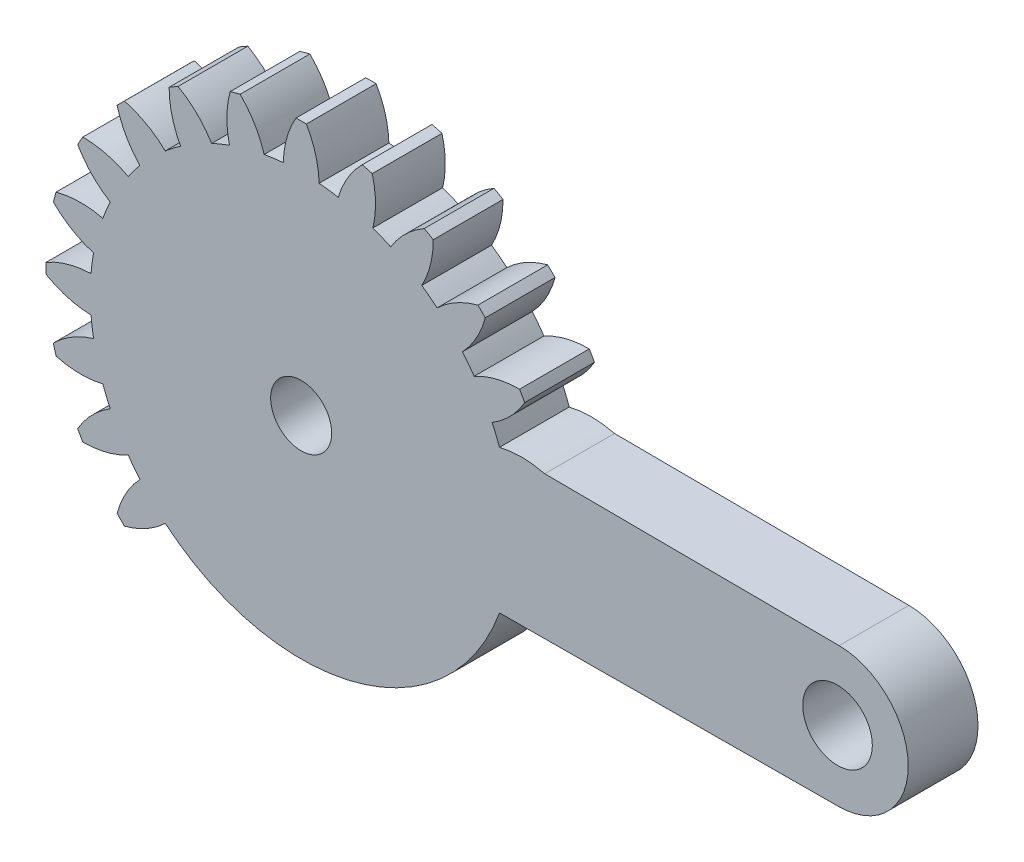
from build123d import *

# Parameters (mm, degrees)
SKETCH1_R           = 12.09
SKETCH1_R_2         = 1.75
SKETCH1_R_3         = 1.995
BOSS_EXTRUDE1_DEPTH = 4


with BuildPart() as part:
    # Sketch1 → Boss-Extrude1 (new body)
    # profile 1 of 22: a face of its own
    with BuildSketch(Plane.XY):
        Circle(SKETCH1_R)
        Circle(SKETCH1_R_2, mode=Mode.SUBTRACT)
    # profile 2 of 22: a face of its own
    with BuildSketch(Plane.XY):
        with BuildLine():
            ThreePointArc((14.051469909, -4.073462091), (14.048317136, -4.084321933), (14.04515597, -4.095179336))
            Line((14.04515597, -4.095179336), (30.82582707, -3.999919373))
            ThreePointArc((30.82582707, -3.999919373), (34.803112279, -0.008027822), (30.841914591, 3.999828048))
            Line((30.841914591, 3.999828048), (14.04515597, 4.095179336))
            ThreePointArc((14.04515597, 4.095179336), (14.128586435, 3.797360314), (14.205702589, 3.497844187))
            ThreePointArc((14.205702589, 3.497844187), (14.50484412, 1.909554151), (14.626965513, 0.297959519))
            ThreePointArc((14.626965513, 0.297959519), (14.629241359, 0.148987485), (14.63, 0))
            ThreePointArc((14.63, 0), (14.629241116, -0.149011314), (14.626964543, -0.298007168))
            ThreePointArc((14.626964543, -0.298007168), (14.504858624, -1.909443973), (14.20576712, -3.497582099))
            ThreePointArc((14.20576712, -3.497582099), (14.131552306, -3.786308154), (14.051469909, -4.073462091))
        make_face()
        with Locations((30.75, 0)):
            Circle(SKETCH1_R_3, mode=Mode.SUBTRACT)
    # profile 3 of 22: a face of its own
    with BuildSketch(Plane.XY):
        with BuildLine():
            ThreePointArc((14.205702589, 3.497844187), (14.128586435, 3.797360314), (14.04515597, 4.095179336))
            Line((14.04515597, 4.095179336), (13.966164937, 4.095627749))
            Line((13.966164937, 4.095627749), (11.369827915, 4.11036655))
            ThreePointArc((11.369827915, 4.11036655), (11.678097516, 3.128919686), (11.901816808, 2.124819208))
            ThreePointArc((11.901816808, 2.124819208), (13.1403578, 2.666023245), (14.205702589, 3.497844187))
        make_face()
    # profile 4 of 22: a face of its own
    with BuildSketch(Plane.XY):
        with BuildLine():
            ThreePointArc((-12.517636695, -7.572692492), (-11.175984377, -7.407777173), (-9.917325106, -6.914821961))
            ThreePointArc((-9.917325106, -6.914821961), (-10.469253219, -6.046721181), (-10.945386333, -5.134843524))
            ThreePointArc((-10.945386333, -5.134843524), (-12.001489862, -5.978375477), (-12.815033037, -7.057749518))
            ThreePointArc((-12.815033037, -7.057749518), (-12.668951436, -7.31673216), (-12.517636695, -7.572692492))
        make_face()
    # profile 5 of 22: a face of its own
    with BuildSketch(Plane.XY):
        with BuildLine():
            ThreePointArc((-14.051145033, -4.074582586), (-12.712516328, -4.262616236), (-11.369129658, -4.112297512))
            ThreePointArc((-11.369129658, -4.112297512), (-11.677558471, -3.130930876), (-11.901445615, -2.126897335))
            ThreePointArc((-11.901445615, -2.126897335), (-13.139881298, -2.668425004), (-14.205038564, -3.500539874))
            ThreePointArc((-14.205038564, -3.500539874), (-14.13100701, -3.788342761), (-14.051145033, -4.074582586))
        make_face()
    # profile 6 of 22: a face of its own
    with BuildSketch(Plane.XY):
        with BuildLine():
            ThreePointArc((-14.626950262, -0.298707293), (-13.382615157, -0.826868574), (-12.046093246, -1.029435529))
            ThreePointArc((-12.046093246, -1.029435529), (-12.089999882, -0.001686428), (-12.046379968, 1.026074882))
            ThreePointArc((-12.046379968, 1.026074882), (-13.382791491, 0.823465153), (-14.62701917, 0.295313712))
            ThreePointArc((-14.62701917, 0.295313712), (-14.629999902, -0.00169714), (-14.626950262, -0.298707293))
        make_face()
    # profile 7 of 22: a face of its own
    with BuildSketch(Plane.XY):
        with BuildLine():
            ThreePointArc((-14.205774364, 3.497552675), (-13.140565234, 2.66528054), (-11.902026335, 2.123645243))
            ThreePointArc((-11.902026335, 2.123645243), (-11.678416405, 3.127729251), (-11.370260409, 4.109170017))
            ThreePointArc((-11.370260409, 4.109170017), (-12.71360248, 4.259309779), (-14.052145793, 4.071129894))
            ThreePointArc((-14.052145793, 4.071129894), (-14.131870386, 3.78512079), (-14.205774364, 3.497552675))
        make_face()
    # profile 8 of 22: a face of its own
    with BuildSketch(Plane.XY):
        with BuildLine():
            ThreePointArc((-9.919135011, 6.912225448), (-11.177872267, 7.404913556), (-12.519533027, 7.569556974))
            ThreePointArc((-12.519533027, 7.569556974), (-12.670533379, 7.313992337), (-12.816317544, 7.055416686))
            ThreePointArc((-12.816317544, 7.055416686), (-12.00284137, 5.975783406), (-10.94671211, 5.132016561))
            ThreePointArc((-10.94671211, 5.132016561), (-10.470825179, 6.043998682), (-9.919135011, 6.912225448))
        make_face()
    # profile 9 of 22: a face of its own
    with BuildSketch(Plane.XY):
        with BuildLine():
            ThreePointArc((-7.791898403, 9.244155952), (-8.880242473, 10.045843984), (-10.13359017, 10.552120653))
            ThreePointArc((-10.13359017, 10.552120653), (-10.345575707, 10.344368676), (-10.553302948, 10.1323589))
            ThreePointArc((-10.553302948, 10.1323589), (-10.04699158, 8.878969486), (-9.245249077, 7.790601357))
            ThreePointArc((-9.245249077, 7.790601357), (-8.549520677, 8.54832125), (-7.791898403, 9.244155952))
        make_face()
    # profile 10 of 22: a face of its own
    with BuildSketch(Plane.XY):
        with BuildLine():
            ThreePointArc((-5.133551517, 10.945992364), (-5.977311447, 12.002061971), (-7.05691548, 12.815492339))
            ThreePointArc((-7.05691548, 12.815492339), (-7.315469666, 12.669680484), (-7.571012334, 12.518652972))
            ThreePointArc((-7.571012334, 12.518652972), (-7.40634855, 11.176941958), (-6.913615931, 9.918165897))
            ThreePointArc((-6.913615931, 9.918165897), (-6.045466706, 10.469977665), (-5.133551517, 10.945992364))
        make_face()
    # profile 11 of 22: a face of its own
    with BuildSketch(Plane.XY):
        with BuildLine():
            ThreePointArc((-2.125311093, 11.901728982), (-2.666957342, 13.14020836), (-3.499215334, 14.205364904))
            ThreePointArc((-3.499215334, 14.205364904), (-3.786765286, 14.131429817), (-4.072755654, 14.051674682))
            ThreePointArc((-4.072755654, 14.051674682), (-4.260931239, 12.713077321), (-4.110760617, 11.369685446))
            ThreePointArc((-4.110760617, 11.369685446), (-3.129363382, 11.677978627), (-2.125311093, 11.901728982))
        make_face()
    # profile 12 of 22: a face of its own
    with BuildSketch(Plane.XY):
        with BuildLine():
            ThreePointArc((1.027754616, 12.046236775), (0.825159863, 13.382704508), (0.296996585, 14.626985097))
            ThreePointArc((0.296996585, 14.626985097), (0, 14.63), (-0.296996585, 14.626985097))
            ThreePointArc((-0.296996585, 14.626985097), (-0.825159863, 13.382704508), (-1.027754616, 12.046236775))
            ThreePointArc((-1.027754616, 12.046236775), (0, 12.09), (1.027754616, 12.046236775))
        make_face()
    # profile 13 of 22: a face of its own
    with BuildSketch(Plane.XY):
        with BuildLine():
            ThreePointArc((4.110717434, 11.369701059), (4.260994095, 12.713043392), (4.072942889, 14.051620413))
            ThreePointArc((4.072942889, 14.051620413), (3.786710214, 14.131444574), (3.498915331, 14.2054388))
            ThreePointArc((3.498915331, 14.2054388), (2.666773966, 13.14023428), (2.125244746, 11.901740829))
            ThreePointArc((2.125244746, 11.901740829), (3.129308654, 11.677993293), (4.110717434, 11.369701059))
        make_face()
    # profile 14 of 22: a face of its own
    with BuildSketch(Plane.XY):
        with BuildLine():
            ThreePointArc((6.913450185, 9.91828143), (7.406352802, 11.176909529), (7.571236986, 12.518517105))
            ThreePointArc((7.571236986, 12.518517105), (7.315275528, 12.669792577), (7.056292749, 12.81583523))
            ThreePointArc((7.056292749, 12.81583523), (5.976880257, 12.002254067), (5.133331053, 10.946095756))
            ThreePointArc((5.133331053, 10.946095756), (6.045273784, 10.470089058), (6.913450185, 9.91828143))
        make_face()
    # profile 15 of 22: a face of its own
    with BuildSketch(Plane.XY):
        with BuildLine():
            ThreePointArc((9.244954117, 7.790951378), (10.046869152, 8.879052728), (10.553440202, 10.132215942))
            ThreePointArc((10.553440202, 10.132215942), (10.345229175, 10.344715236), (10.132740224, 10.552936821))
            ThreePointArc((10.132740224, 10.552936821), (8.879594749, 10.046380548), (7.791503622, 9.244488699))
            ThreePointArc((7.791503622, 9.244488699), (8.549176321, 8.548665641), (9.244954117, 7.790951378))
        make_face()
    # profile 16 of 22: a face of its own
    with BuildSketch(Plane.XY):
        with BuildLine():
            ThreePointArc((10.946374382, 5.132736881), (12.002615026, 5.976132183), (12.81632055, 7.055411226))
            ThreePointArc((12.81632055, 7.055411226), (12.670115094, 7.314716911), (12.518663963, 7.570994161))
            ThreePointArc((12.518663963, 7.570994161), (11.17714698, 7.405952739), (9.918639175, 6.912936924))
            ThreePointArc((9.918639175, 6.912936924), (10.47040953, 6.044718709), (10.946374382, 5.132736881))
        make_face()
    # profile 17 of 22: a face of its own
    with BuildSketch(Plane.XY):
        with BuildLine():
            ThreePointArc((12.046231207, -1.027819886), (11.986581537, -1.577961676), (11.901820644, -2.124797724))
            ThreePointArc((11.901820644, -2.124797724), (13.140374441, -2.665881604), (14.20576712, -3.497582099))
            ThreePointArc((14.20576712, -3.497582099), (14.504858624, -1.909443973), (14.626964543, -0.298007168))
            ThreePointArc((14.626964543, -0.298007168), (13.382627003, -0.825679814), (12.046231207, -1.027819886))
        make_face()
    # profile 18 of 22: a face of its own
    with BuildSketch(Plane.XY):
        with BuildLine():
            ThreePointArc((11.901820644, -2.124797724), (11.67810034, -3.128909147), (11.369827915, -4.11036655))
            Line((11.369827915, -4.11036655), (13.967019497, -4.095622898))
            ThreePointArc((13.967019497, -4.095622898), (14.009289492, -4.084713176), (14.051469909, -4.073462091))
            ThreePointArc((14.051469909, -4.073462091), (14.131552306, -3.786308154), (14.20576712, -3.497582099))
            ThreePointArc((14.20576712, -3.497582099), (13.140374441, -2.665881604), (11.901820644, -2.124797724))
        make_face()
    # profile 19 of 22: a face of its own
    with BuildSketch(Plane.XY):
        with BuildLine():
            ThreePointArc((12.09, 0), (12.079052845, -0.514375696), (12.046231207, -1.027819886))
            ThreePointArc((12.046231207, -1.027819886), (13.382627003, -0.825679814), (14.626964543, -0.298007168))
            ThreePointArc((14.626964543, -0.298007168), (14.629241116, -0.149011314), (14.63, 0))
            ThreePointArc((14.63, 0), (14.629241359, 0.148987485), (14.626965513, 0.297959519))
            ThreePointArc((14.626965513, 0.297959519), (13.382629481, 0.825632028), (12.046235232, 1.027772701))
            ThreePointArc((12.046235232, 1.027772701), (12.079053853, 0.514352039), (12.09, 0))
        make_face()
    # profile 20 of 22: a face of its own
    with BuildSketch(Plane.XY):
        with BuildLine():
            ThreePointArc((11.901816808, 2.124819208), (11.986583203, 1.577949019), (12.046235232, 1.027772701))
            ThreePointArc((12.046235232, 1.027772701), (13.382629481, 0.825632028), (14.626965513, 0.297959519))
            ThreePointArc((14.626965513, 0.297959519), (14.50484412, 1.909554151), (14.205702589, 3.497844187))
            ThreePointArc((14.205702589, 3.497844187), (13.1403578, 2.666023245), (11.901816808, 2.124819208))
        make_face()
    # profile 21 of 22: a face of its own
    with BuildSketch(Plane.XY):
        with BuildLine():
            Line((11.369827915, 4.11036655), (13.966164937, 4.095627749))
            ThreePointArc((13.966164937, 4.095627749), (12.668895431, 4.261362771), (11.369827915, 4.11036655))
        make_face()
    # profile 22 of 22: a face of its own
    with BuildSketch(Plane.XY):
        with BuildLine():
            ThreePointArc((-10.130994605, -10.554612656), (-8.877796666, -10.047999865), (-7.789679206, -9.246026058))
            ThreePointArc((-7.789679206, -9.246026058), (-8.547489799, -8.550351931), (-9.243417598, -7.792774288))
            ThreePointArc((-9.243417598, -7.792774288), (-10.045261463, -8.880834456), (-10.55179143, -10.133932978))
            ThreePointArc((-10.55179143, -10.133932978), (-10.343531911, -10.346412306), (-10.130994605, -10.554612656))
        make_face()
    extrude(amount=BOSS_EXTRUDE1_DEPTH)


solid = part.part
